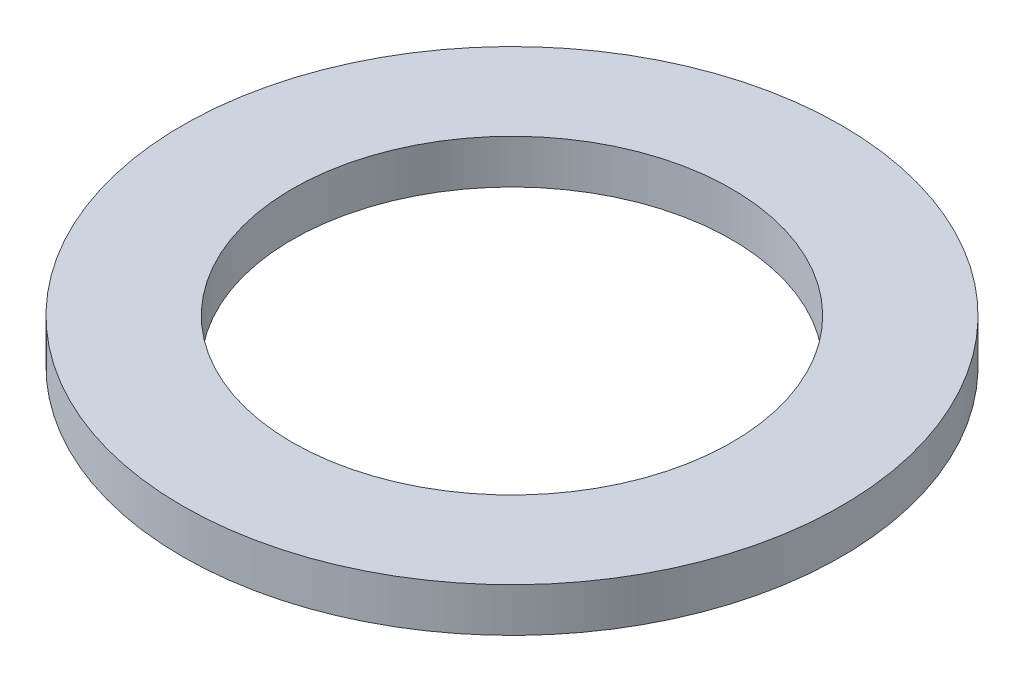
from build123d import *

# Parameters (mm, degrees)
SKETCH1_R           = 15
SKETCH1_R_2         = 10
BOSS_EXTRUDE1_DEPTH = 2


with BuildPart() as part:
    # Sketch1 → Boss-Extrude1 (new body)
    with BuildSketch(Plane(origin=(0, 0, 0), x_dir=(1, 0, 0), z_dir=(0, 1, 0))):
        with Locations(Location((0, 0, 0), (0, 0, 270))):
            Circle(SKETCH1_R)
        with Locations(Location((0, 0, 0), (0, 0, 270))):
            Circle(SKETCH1_R_2, mode=Mode.SUBTRACT)
    extrude(amount=BOSS_EXTRUDE1_DEPTH)


solid = part.part
